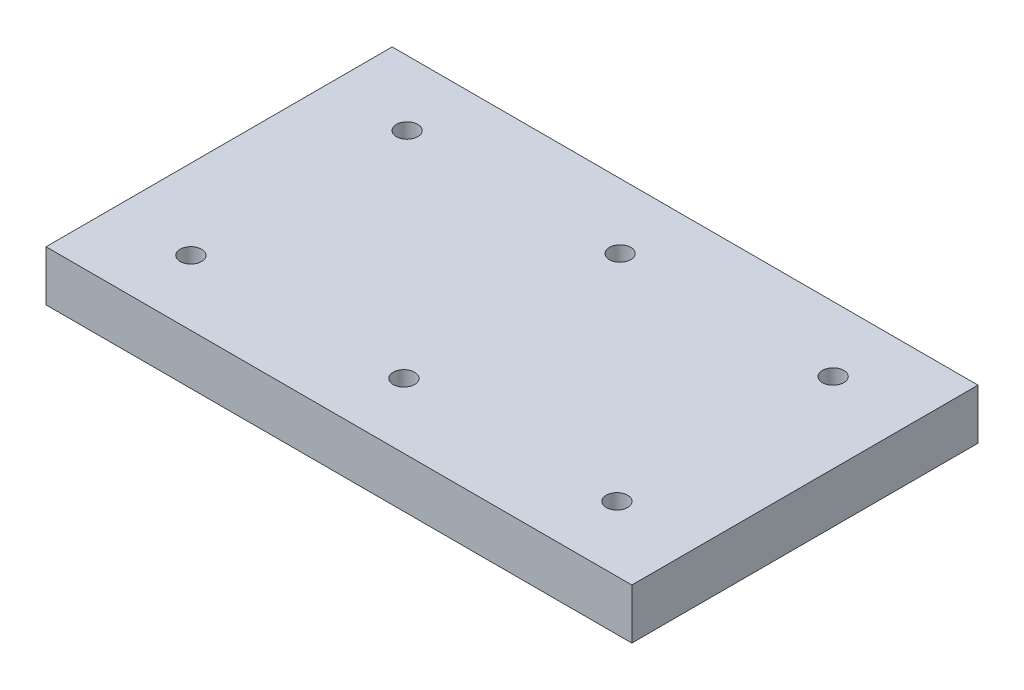
from build123d import *

# Parameters (mm, degrees)
SKETCH1_W              = 139.7
SKETCH1_H              = 82.55
BOSS_EXTRUDE1_DEPTH    = 12
F_10_CLEARANCE_HOLE1_D = 5.1054


with BuildPart() as part:
    # Sketch1 → Boss-Extrude1 (new body)
    with BuildSketch(Plane(origin=(0, 0, 0), x_dir=(1, 0, 0), z_dir=(0, 1, 0))):
        Rectangle(SKETCH1_W, SKETCH1_H)
    extrude(amount=BOSS_EXTRUDE1_DEPTH)

    # #10 Clearance Hole1 (through all)
    with Locations(Plane(origin=(0, 0, 0), x_dir=(-1, 0, 0), z_dir=(0, -1, 0))):
        with Locations((-50.8, 25.781), (0, 25.781), (50.8, 25.781), (50.8, -25.781), (0, -25.781), (-50.8, -25.781)):
            Hole(F_10_CLEARANCE_HOLE1_D / 2)


solid = part.part
